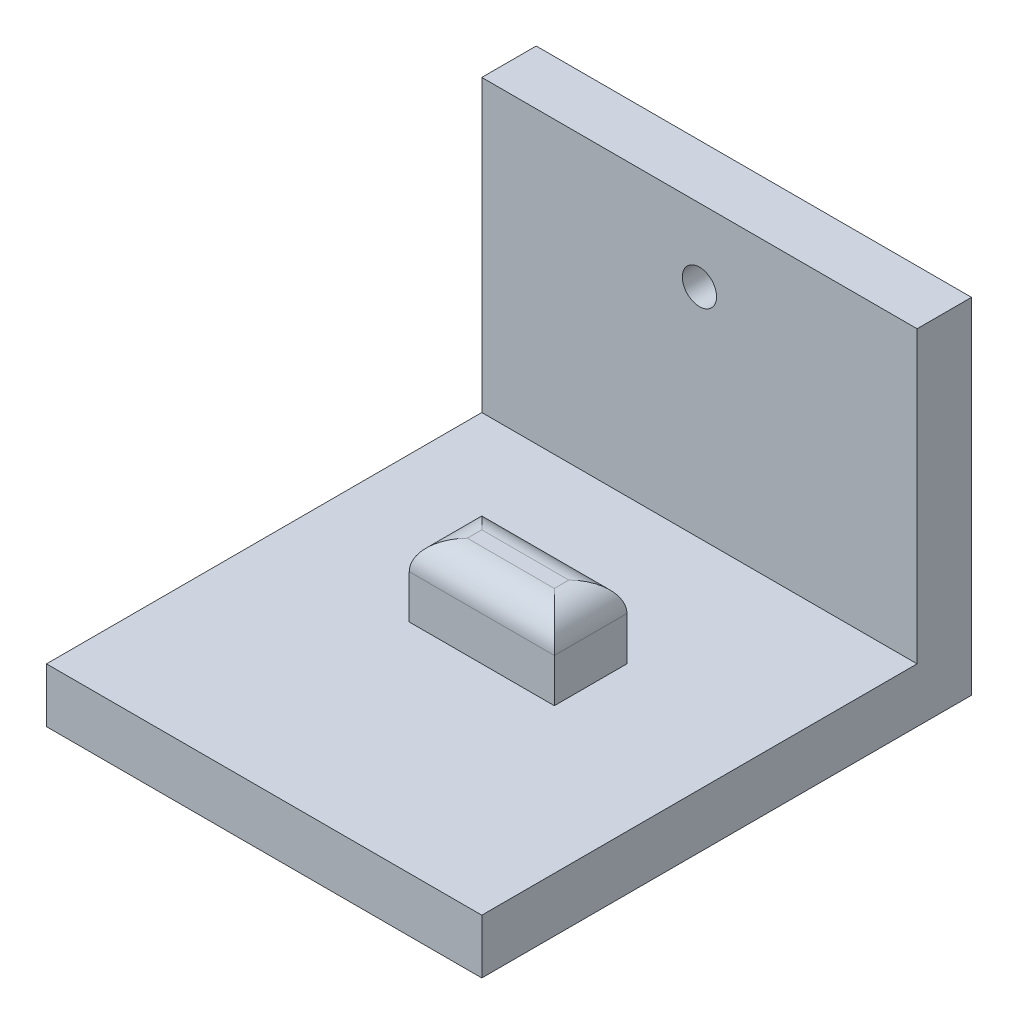
from build123d import *

# Parameters (mm, degrees)
BOSS_EXTRUDE1_DEPTH = 38.1
SKETCH2_W           = 12.7
SKETCH2_H           = 6.35
BOSS_EXTRUDE2_DEPTH = 6.35
SKETCH3_R           = 1.499997
CUT_EXTRUDE1_DEPTH  = 62.749464826
FILLET1_R           = 2.54


with BuildPart() as part:
    # Sketch1 → Boss-Extrude1 (new body)
    with BuildSketch(Plane(origin=(0, 0, 0), x_dir=(0, 0, -1), z_dir=(1, 0, 0))):
        Polygon((0, 0), (-42.8625, 0), (-42.8625, 4.7625), (-4.7625, 4.7625), (-4.7625, 30.1625), (0, 30.1625), align=None)
    extrude(amount=BOSS_EXTRUDE1_DEPTH)

    # Sketch2 → Boss-Extrude2 (add)
    with BuildSketch(Plane(origin=(0, 4.7625, 0), x_dir=(1, 0, 0), z_dir=(0, 1, 0))):
        with Locations((19.05, -20.6375)):
            Rectangle(SKETCH2_W, SKETCH2_H)
    extrude(amount=BOSS_EXTRUDE2_DEPTH)

    # Sketch3 → Cut-Extrude1 (cut, through all)
    with BuildSketch(Plane.XY.offset(4.7625)):
        with Locations((19.05, 23.8125)):
            Circle(SKETCH3_R)
    extrude(amount=-CUT_EXTRUDE1_DEPTH, mode=Mode.SUBTRACT)

    # Fillet1
    fillet1_edges = [part.edges().sort_by_distance(p)[0] for p in [
        (12.7, 11.1125, 20.6375),
        (19.05, 11.1125, 23.8125),
        (25.4, 11.1125, 20.6375),
        (19.05, 11.1125, 17.4625),
    ]]
    fillet(fillet1_edges, radius=FILLET1_R)


solid = part.part
